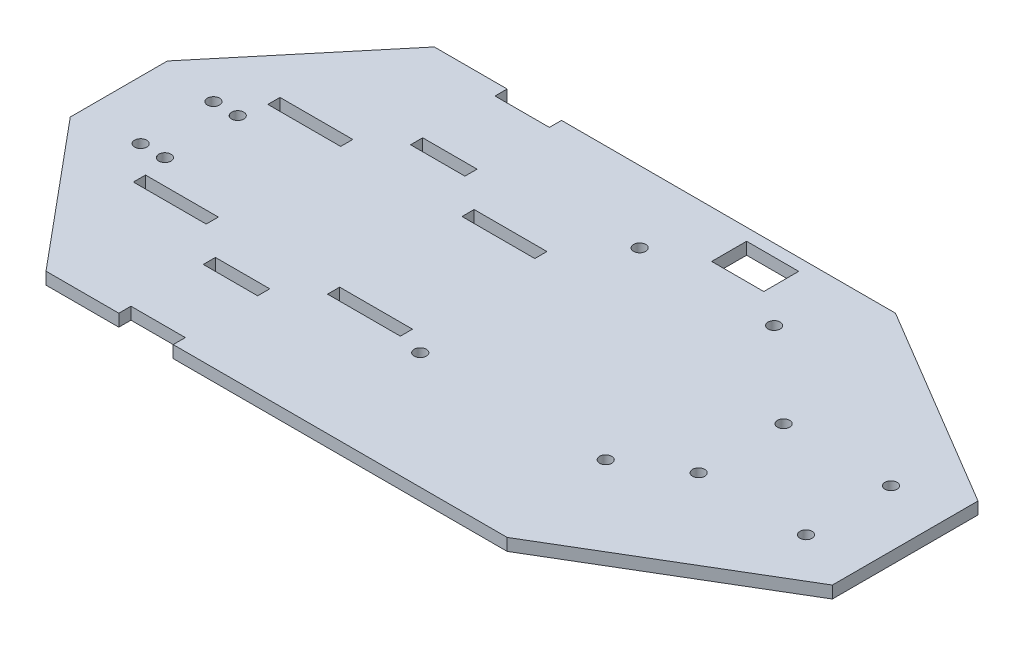
from build123d import *

# Parameters (mm, degrees)
SKETCH1_W           = 14.224
SKETCH1_H           = 3.175
SKETCH1_W_2         = 19.05
SKETCH1_R           = 1.5875
SKETCH1_W_3         = 13.6398
SKETCH1_H_2         = 9.144
BOSS_EXTRUDE1_DEPTH = 3.175
SKETCH2_R           = 1.5875
CUT_EXTRUDE1_DEPTH  = 3.175
CUT_EXTRUDE2_DEPTH  = 251.18113563


with BuildPart() as part:
    # Sketch1 → Boss-Extrude1 (new body)
    with BuildSketch(Plane(origin=(0, 0, 0), x_dir=(1, 0, 0), z_dir=(0, 1, 0))):
        Polygon((0, 101.6), (0, 0), (50.8, 0), (50.8, 3.175), (65.024, 3.175), (65.024, 0), (228.6, 0), (228.6, 101.6), (65.024, 101.6), (65.024, 98.425), (50.8, 98.425), (50.8, 101.6), align=None)
        with Locations((57.912, 23.6855)):
            Rectangle(SKETCH1_W, SKETCH1_H, mode=Mode.SUBTRACT)
        with Locations((32.512, 33.2105)):
            Rectangle(SKETCH1_W_2, SKETCH1_H, mode=Mode.SUBTRACT)
        with Locations((83.312, 33.2105)):
            Rectangle(SKETCH1_W_2, SKETCH1_H, mode=Mode.SUBTRACT)
        with Locations(Location((99.187, 30.48, 0), (0, 0, 270))):
            Circle(SKETCH1_R, mode=Mode.SUBTRACT)
        with Locations(Location((147.701, 30.48, 0), (0, 0, 270))):
            Circle(SKETCH1_R, mode=Mode.SUBTRACT)
        with Locations(Location((162.814, 39.6875, 0), (0, 0, 270))):
            Circle(SKETCH1_R, mode=Mode.SUBTRACT)
        with Locations(Location((190.91275, 39.6875, 0), (0, 0, 270))):
            Circle(SKETCH1_R, mode=Mode.SUBTRACT)
        with Locations((32.512, 68.3895)):
            Rectangle(SKETCH1_W_2, SKETCH1_H, mode=Mode.SUBTRACT)
        with Locations((83.312, 68.3895)):
            Rectangle(SKETCH1_W_2, SKETCH1_H, mode=Mode.SUBTRACT)
        with Locations((57.912, 77.9145)):
            Rectangle(SKETCH1_W, SKETCH1_H, mode=Mode.SUBTRACT)
        with Locations(Location((104.14, 82.931, 0), (0, 0, 270))):
            Circle(SKETCH1_R, mode=Mode.SUBTRACT)
        with Locations(Location((162.814, 61.9125, 0), (0, 0, 270))):
            Circle(SKETCH1_R, mode=Mode.SUBTRACT)
        with Locations(Location((190.91275, 61.9125, 0), (0, 0, 270))):
            Circle(SKETCH1_R, mode=Mode.SUBTRACT)
        with Locations(Location((139.319, 82.931, 0), (0, 0, 270))):
            Circle(SKETCH1_R, mode=Mode.SUBTRACT)
        with Locations((123.444, 93.853)):
            Rectangle(SKETCH1_W_3, SKETCH1_H_2, mode=Mode.SUBTRACT)
    extrude(amount=BOSS_EXTRUDE1_DEPTH)

    # Sketch2 → Cut-Extrude1 (cut)
    with BuildSketch(Plane(origin=(0, 3.175, 0), x_dir=(1, 0, 0), z_dir=(0, 1, 0))):
        with Locations(Location((15.24, 60.325, 0), (0, 0, 270))):
            Circle(SKETCH2_R)
        with Locations(Location((15.24, 41.275, 0), (0, 0, 270))):
            Circle(SKETCH2_R)
        with Locations(Location((21.59, 41.275, 0), (0, 0, 270))):
            Circle(SKETCH2_R)
        with Locations(Location((21.59, 60.325, 0), (0, 0, 270))):
            Circle(SKETCH2_R)
    extrude(amount=-CUT_EXTRUDE1_DEPTH, mode=Mode.SUBTRACT)

    # Sketch3 → Cut-Extrude2 (cut, through all)
    with BuildSketch(Plane(origin=(0, 3.175, 0), x_dir=(1, 0, 0), z_dir=(0, 1, 0))):
        Polygon((0, 63.5), (31.75, 101.6), (0, 101.6), align=None)
        Polygon((152.4, 101.6), (205.74, 69.85), (205.74, 31.75), (152.4, 0), (228.6, 0), (228.6, 44.45), (228.6, 57.15), (228.6, 101.6), align=None)
        Polygon((31.75, 0), (0, 0), (0, 38.1), align=None)
    extrude(amount=-CUT_EXTRUDE2_DEPTH, mode=Mode.SUBTRACT)


solid = part.part
